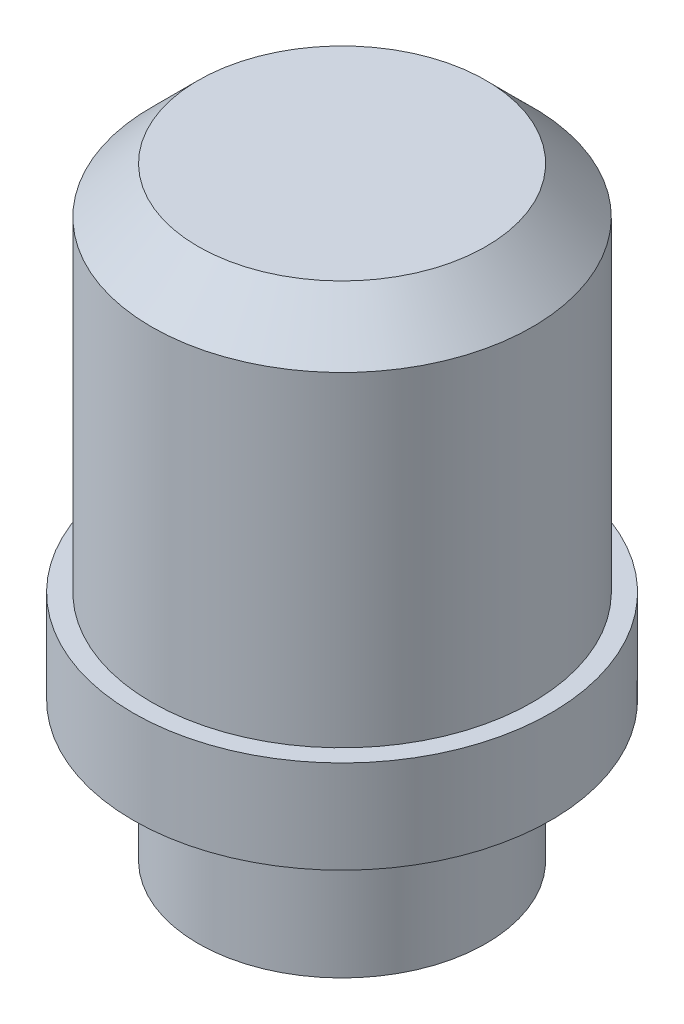
from build123d import *

# Parameters (mm, degrees)
SKETCH1_R           = 3.1
BOSS_EXTRUDE1_DEPTH = 5
SKETCH2_R           = 4.5
BOSS_EXTRUDE2_DEPTH = 2
SKETCH3_R           = 4.1
BOSS_EXTRUDE3_DEPTH = 8
CHAMFER1_SIZE       = 1


with BuildPart() as part:
    # Sketch1 → Boss-Extrude1 (new body)
    with BuildSketch(Plane(origin=(0, 0, 0), x_dir=(1, 0, 0), z_dir=(0, 1, 0))):
        with Locations(Location((0, 0, 0), (0, 0, 270))):
            Circle(SKETCH1_R)
    extrude(amount=BOSS_EXTRUDE1_DEPTH)

    # Sketch2 → Boss-Extrude2 (add)
    with BuildSketch(Plane(origin=(0, 3, 0), x_dir=(1, 0, 0), z_dir=(0, 1, 0))):
        with Locations(Location((0, 0, 0), (0, 0, 270))):
            Circle(SKETCH2_R)
    extrude(amount=BOSS_EXTRUDE2_DEPTH)

    # Sketch3 → Boss-Extrude3 (add)
    with BuildSketch(Plane(origin=(0, 5, 0), x_dir=(1, 0, 0), z_dir=(0, 1, 0))):
        with Locations(Location((0, 0, 0), (0, 0, 270))):
            Circle(SKETCH3_R)
    extrude(amount=BOSS_EXTRUDE3_DEPTH)

    # Chamfer1
    chamfer1_edges = [part.edges().sort_by_distance(p)[0] for p in [
        (0, 13, -4.1),
    ]]
    chamfer(chamfer1_edges, length=CHAMFER1_SIZE)


solid = part.part
